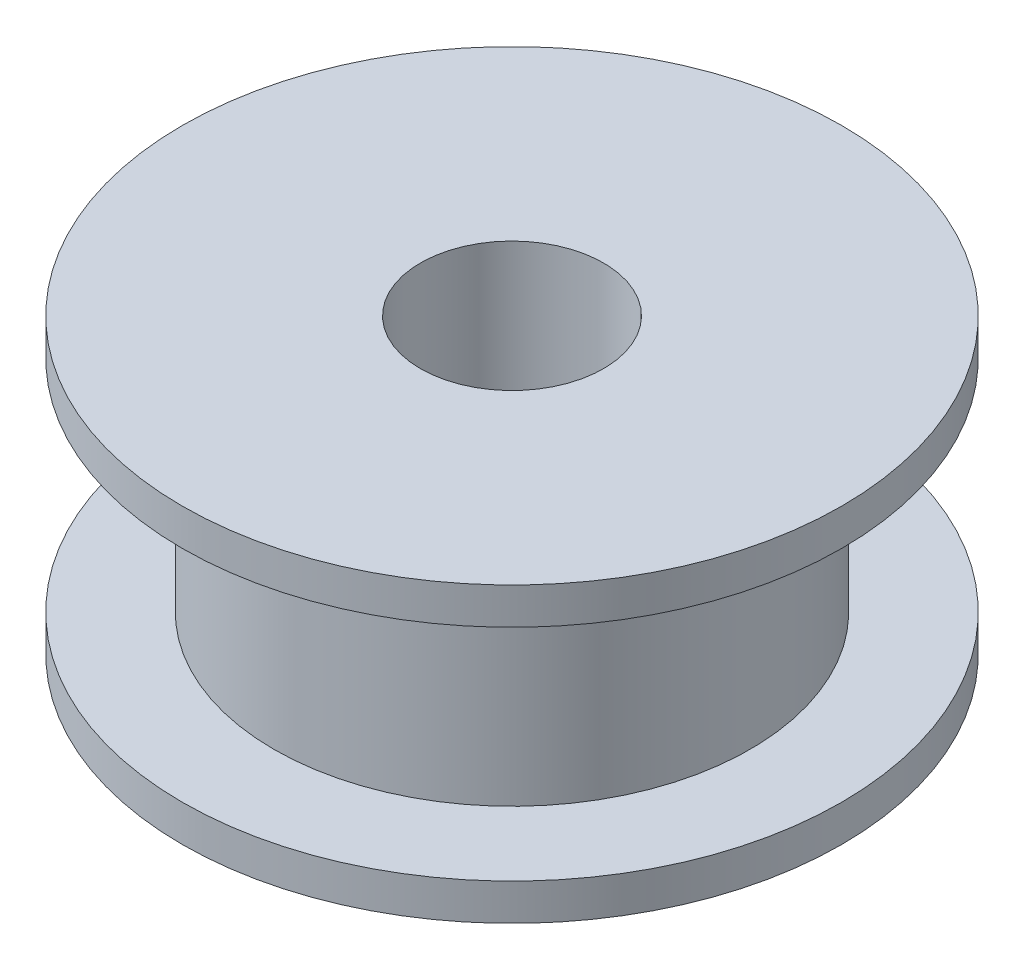
from build123d import *

# Parameters (mm, degrees)
SKETCH1_R           = 9
SKETCH1_R_2         = 2.5
BOSS_EXTRUDE1_DEPTH = 1
SKETCH2_R           = 6.5
SKETCH2_R_2         = 2.5
BOSS_EXTRUDE2_DEPTH = 6
SKETCH3_R           = 9
SKETCH3_R_2         = 2.5
BOSS_EXTRUDE3_DEPTH = 1


with BuildPart() as part:
    # Sketch1 → Boss-Extrude1 (new body)
    with BuildSketch(Plane(origin=(0, 0, 0), x_dir=(1, 0, 0), z_dir=(0, 1, 0))):
        with Locations(Location((0, 0, 0), (0, 0, 270))):
            Circle(SKETCH1_R)
        with Locations(Location((0, 0, 0), (0, 0, 270))):
            Circle(SKETCH1_R_2, mode=Mode.SUBTRACT)
    extrude(amount=BOSS_EXTRUDE1_DEPTH)

    # Sketch2 → Boss-Extrude2 (add)
    with BuildSketch(Plane(origin=(0, 1, 0), x_dir=(1, 0, 0), z_dir=(0, 1, 0))):
        with Locations(Location((0, 0, 0), (0, 0, 270))):
            Circle(SKETCH2_R)
        with Locations(Location((0, 0, 0), (0, 0, 270))):
            Circle(SKETCH2_R_2, mode=Mode.SUBTRACT)
    extrude(amount=BOSS_EXTRUDE2_DEPTH)

    # Sketch3 → Boss-Extrude3 (add)
    with BuildSketch(Plane(origin=(0, 7, 0), x_dir=(1, 0, 0), z_dir=(0, 1, 0))):
        with Locations(Location((0, 0, 0), (0, 0, 270))):
            Circle(SKETCH3_R)
        with Locations(Location((0, 0, 0), (0, 0, 270))):
            Circle(SKETCH3_R_2, mode=Mode.SUBTRACT)
    extrude(amount=BOSS_EXTRUDE3_DEPTH)


solid = part.part
